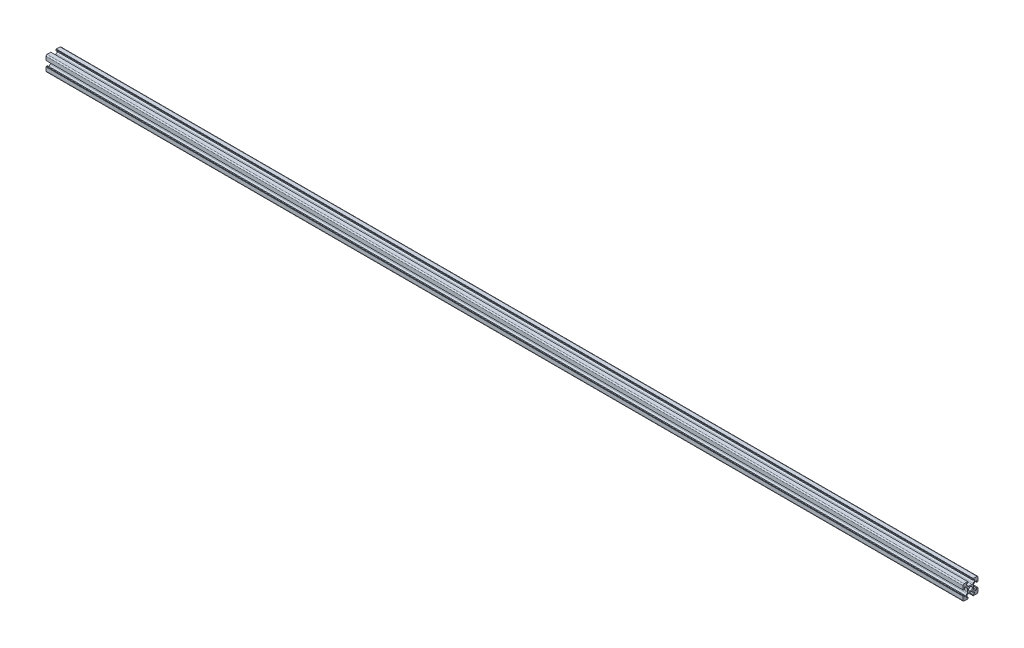
from build123d import *

# Parameters (mm, degrees)
SKETCH2_R           = 2.5
BOSS_EXTRUDE1_DEPTH = 609.6


with BuildPart() as part:
    # Sketch2 → Boss-Extrude1 (new, symmetric)
    with BuildSketch(Plane.YZ):
        with BuildLine():
            Line((-10, 3.6), (-9.5, 3.6))
            Line((-9.5, 3.6), (-9.5, 3.1))
            Line((-9.5, 3.1), (-8.2, 3.1))
            Line((-8.2, 3.1), (-8.2, 5.5))
            Line((-8.2, 5.5), (-6.560660172, 5.5))
            Line((-6.560660172, 5.5), (-4.485786438, 3.425126266))
            ThreePointArc((-4.485786438, 3.425126266), (-4.052240935, 2.776279568), (-3.9, 2.010912703))
            Line((-3.9, 2.010912703), (-3.9, -2.010912703))
            ThreePointArc((-3.9, -2.010912703), (-4.052240935, -2.776279568), (-4.485786438, -3.425126266))
            Line((-4.485786438, -3.425126266), (-6.560660172, -5.5))
            Line((-6.560660172, -5.5), (-8.2, -5.5))
            Line((-8.2, -5.5), (-8.2, -3.1))
            Line((-8.2, -3.1), (-9.5, -3.1))
            Line((-9.5, -3.1), (-9.5, -3.6))
            Line((-9.5, -3.6), (-10, -3.6))
            Line((-10, -3.6), (-10, -8.5))
            ThreePointArc((-10, -8.5), (-9.560660172, -9.560660172), (-8.5, -10))
            Line((-8.5, -10), (-3.6, -10))
            Line((-3.6, -10), (-3.6, -9.5))
            Line((-3.6, -9.5), (-3.1, -9.5))
            Line((-3.1, -9.5), (-3.1, -8.2))
            Line((-3.1, -8.2), (-5.5, -8.2))
            Line((-5.5, -8.2), (-5.5, -6.560660172))
            Line((-5.5, -6.560660172), (-3.425126266, -4.485786438))
            ThreePointArc((-3.425126266, -4.485786438), (-2.776279568, -4.052240935), (-2.010912703, -3.9))
            Line((-2.010912703, -3.9), (2.010912703, -3.9))
            ThreePointArc((2.010912703, -3.9), (2.776279568, -4.052240935), (3.425126266, -4.485786438))
            Line((3.425126266, -4.485786438), (5.5, -6.560660172))
            Line((5.5, -6.560660172), (5.5, -8.2))
            Line((5.5, -8.2), (3.1, -8.2))
            Line((3.1, -8.2), (3.1, -9.5))
            Line((3.1, -9.5), (3.6, -9.5))
            Line((3.6, -9.5), (3.6, -10))
            Line((3.6, -10), (8.5, -10))
            ThreePointArc((8.5, -10), (9.560660172, -9.560660172), (10, -8.5))
            Line((10, -8.5), (10, -3.6))
            Line((10, -3.6), (9.5, -3.6))
            Line((9.5, -3.6), (9.5, -3.1))
            Line((9.5, -3.1), (8.2, -3.1))
            Line((8.2, -3.1), (8.2, -5.5))
            Line((8.2, -5.5), (6.560660172, -5.5))
            Line((6.560660172, -5.5), (4.485786438, -3.425126266))
            ThreePointArc((4.485786438, -3.425126266), (4.052240935, -2.776279568), (3.9, -2.010912703))
            Line((3.9, -2.010912703), (3.9, 2.010912703))
            ThreePointArc((3.9, 2.010912703), (4.052240935, 2.776279568), (4.485786438, 3.425126266))
            Line((4.485786438, 3.425126266), (6.560660172, 5.5))
            Line((6.560660172, 5.5), (8.2, 5.5))
            Line((8.2, 5.5), (8.2, 3.1))
            Line((8.2, 3.1), (9.5, 3.1))
            Line((9.5, 3.1), (9.5, 3.6))
            Line((9.5, 3.6), (10, 3.6))
            Line((10, 3.6), (10, 8.5))
            ThreePointArc((10, 8.5), (9.560660172, 9.560660172), (8.5, 10))
            Line((8.5, 10), (3.6, 10))
            Line((3.6, 10), (3.6, 9.5))
            Line((3.6, 9.5), (3.1, 9.5))
            Line((3.1, 9.5), (3.1, 8.2))
            Line((3.1, 8.2), (5.5, 8.2))
            Line((5.5, 8.2), (5.5, 6.560660172))
            Line((5.5, 6.560660172), (3.425126266, 4.485786438))
            ThreePointArc((3.425126266, 4.485786438), (2.776279568, 4.052240935), (2.010912703, 3.9))
            Line((2.010912703, 3.9), (-2.010912703, 3.9))
            ThreePointArc((-2.010912703, 3.9), (-2.776279568, 4.052240935), (-3.425126266, 4.485786438))
            Line((-3.425126266, 4.485786438), (-5.5, 6.560660172))
            Line((-5.5, 6.560660172), (-5.5, 8.2))
            Line((-5.5, 8.2), (-3.1, 8.2))
            Line((-3.1, 8.2), (-3.1, 9.5))
            Line((-3.1, 9.5), (-3.6, 9.5))
            Line((-3.6, 9.5), (-3.6, 10))
            Line((-3.6, 10), (-8.5, 10))
            ThreePointArc((-8.5, 10), (-9.560660172, 9.560660172), (-10, 8.5))
            Line((-10, 8.5), (-10, 3.6))
        make_face()
        with Locations(Location((0, 0, 0), (0, 0, 90))):
            Circle(SKETCH2_R, mode=Mode.SUBTRACT)
    extrude(amount=BOSS_EXTRUDE1_DEPTH, both=True)


solid = part.part
